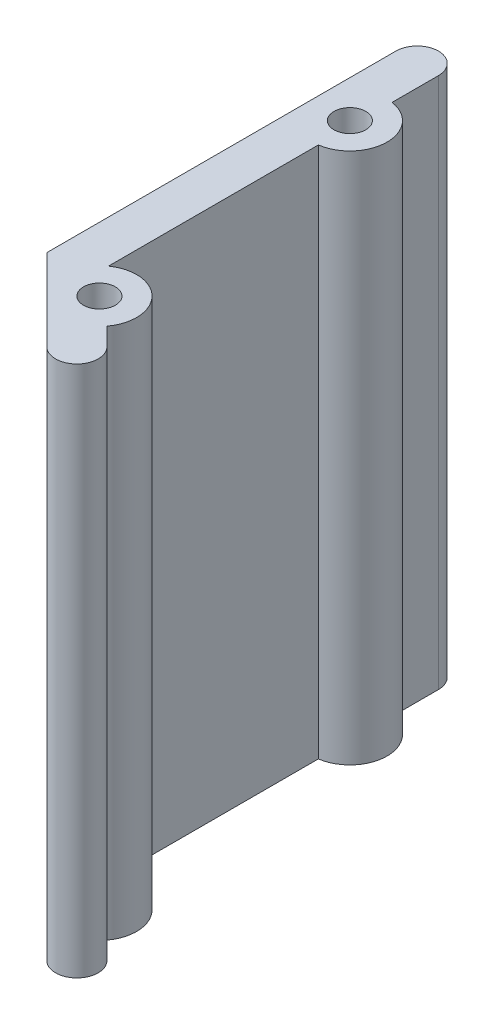
from build123d import *
from build123d.topology import SkipClean

# Parameters (mm, degrees)
BOSS_EXTRUDE1_DEPTH = 50
SKETCH5_R           = 3.5
SKETCH5_R_2         = 1.5
BOSS_EXTRUDE2_DEPTH = 50
SKETCH6_R           = 1.5
CUT_EXTRUDE1_DEPTH  = 10
CUT_EXTRUDE2_START  = -10
SKETCH7_R           = 1.5
CUT_EXTRUDE2_DEPTH  = 10


with BuildPart() as part:
    # Sketch1 → Boss-Extrude1 (new body)
    with BuildSketch(Plane(origin=(0, 0, 0), x_dir=(1, 0, 0), z_dir=(0, 1, 0))):
        with BuildLine():
            Line((-2, 32), (-2, -0.828427125))
            Line((-2, -0.828427125), (5.656854249, -8.485281374))
            ThreePointArc((5.656854249, -8.485281374), (8.485281374, -8.485281374), (8.485281374, -5.656854249))
            Line((8.485281374, -5.656854249), (2, 0.828427125))
            Line((2, 0.828427125), (2, 32))
            ThreePointArc((2, 32), (0, 34), (-2, 32))
        make_face()
    extrude(amount=BOSS_EXTRUDE1_DEPTH)

    # Sketch5 → Boss-Extrude2 (add, through all)
    # profile 1 of 2: a face of its own
    with BuildSketch(Plane(origin=(0, 0, 0), x_dir=(-1, 0, 0), z_dir=(0, -1, 0))):
        with Locations((-1.5, 24.171572875)):
            Circle(SKETCH5_R)
        with Locations((-1.5, 24.171572875)):
            Circle(SKETCH5_R_2, mode=Mode.SUBTRACT)
    # profile 2 of 2: a face of its own
    with BuildSketch(Plane(origin=(0, 0, 0), x_dir=(-1, 0, 0), z_dir=(0, -1, 0))):
        with Locations((-4.01040764, -1.889087297)):
            Circle(SKETCH5_R)
        with Locations((-4.01040764, -1.889087297)):
            Circle(SKETCH5_R_2, mode=Mode.SUBTRACT)
    extrude(amount=-BOSS_EXTRUDE2_DEPTH)

    # Sketch6 → Cut-Extrude1 (cut)
    with BuildSketch(Plane(origin=(0, 0, 0), x_dir=(-1, 0, 0), z_dir=(0, -1, 0))):
        with Locations(Location((-4.01040764, -1.889087297, 0), (0, 0, 90))):
            Circle(SKETCH6_R)
        with Locations(Location((-1.5, 24.171572875, 0), (0, 0, 90))):
            Circle(SKETCH6_R)
    extrude(amount=-CUT_EXTRUDE1_DEPTH, mode=Mode.SUBTRACT)

    # Sketch7 → Cut-Extrude2 (cut)
    with SkipClean():  # the faces are left unmerged after this step: merging them gives an invalid solid
        with BuildSketch(Plane(origin=(0, 50, 0), x_dir=(1, 0, 0), z_dir=(0, 1, 0)).offset(CUT_EXTRUDE2_START)):
            with Locations(Location((4.01040764, -1.889087297, 0), (0, 0, 90))):
                Circle(SKETCH7_R)
            with Locations(Location((1.5, 24.171572875, 0), (0, 0, 90))):
                Circle(SKETCH7_R)
        extrude(amount=CUT_EXTRUDE2_DEPTH, mode=Mode.SUBTRACT)


solid = part.part
